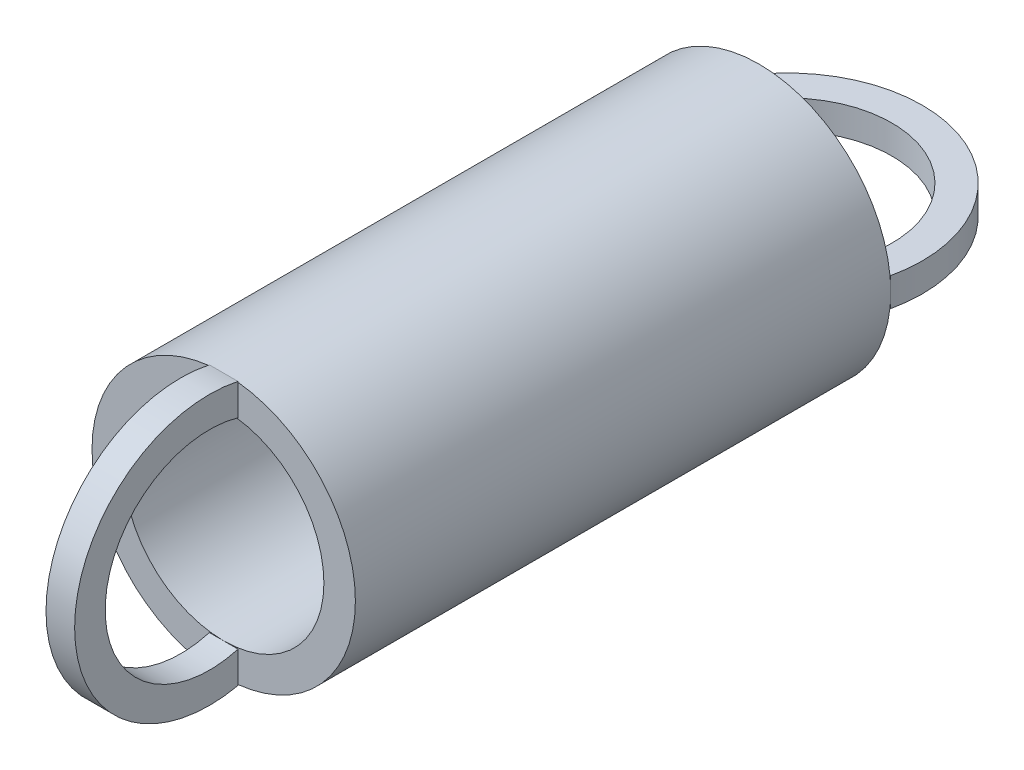
from build123d import *

# Parameters (mm, degrees)
SKETCH1_R           = 4.6
SKETCH1_R_2         = 3.5
BOSS_EXTRUDE1_DEPTH = 9.35
BOSS_EXTRUDE2_DEPTH = 0.5
BOSS_EXTRUDE3_DEPTH = 0.5


with BuildPart() as part:
    # Sketch1 → Boss-Extrude1 (new, symmetric)
    with BuildSketch(Plane.XY):
        Circle(SKETCH1_R)
        Circle(SKETCH1_R_2, mode=Mode.SUBTRACT)
    extrude(amount=BOSS_EXTRUDE1_DEPTH, both=True)

    # Sketch2 → Boss-Extrude2 (add, symmetric)
    with BuildSketch(Plane(origin=(0, 0, 0), x_dir=(0, 0, -1), z_dir=(1, 0, 0))):
        with BuildLine():
            Line((-9.35, -4.6), (-9.35, -3.5))
            ThreePointArc((-9.35, -3.5), (-13.990054945, 0), (-9.35, 3.5))
            Line((-9.35, 3.5), (-9.35, 4.6))
            ThreePointArc((-9.35, 4.6), (-15.057440918, 0), (-9.35, -4.6))
        make_face()
    extrude(amount=BOSS_EXTRUDE2_DEPTH, both=True)

    # Sketch4 → Boss-Extrude3 (add, symmetric)
    with BuildSketch(Plane(origin=(0, 0, 0), x_dir=(1, 0, 0), z_dir=(0, 1, 0))):
        with BuildLine():
            Line((4.6, 9.35), (3.5, 9.35))
            ThreePointArc((3.5, 9.35), (0, 13.990054945), (-3.5, 9.35))
            Line((-3.5, 9.35), (-4.6, 9.35))
            ThreePointArc((-4.6, 9.35), (0, 15.057440918), (4.6, 9.35))
        make_face()
    extrude(amount=BOSS_EXTRUDE3_DEPTH, both=True)


solid = part.part
